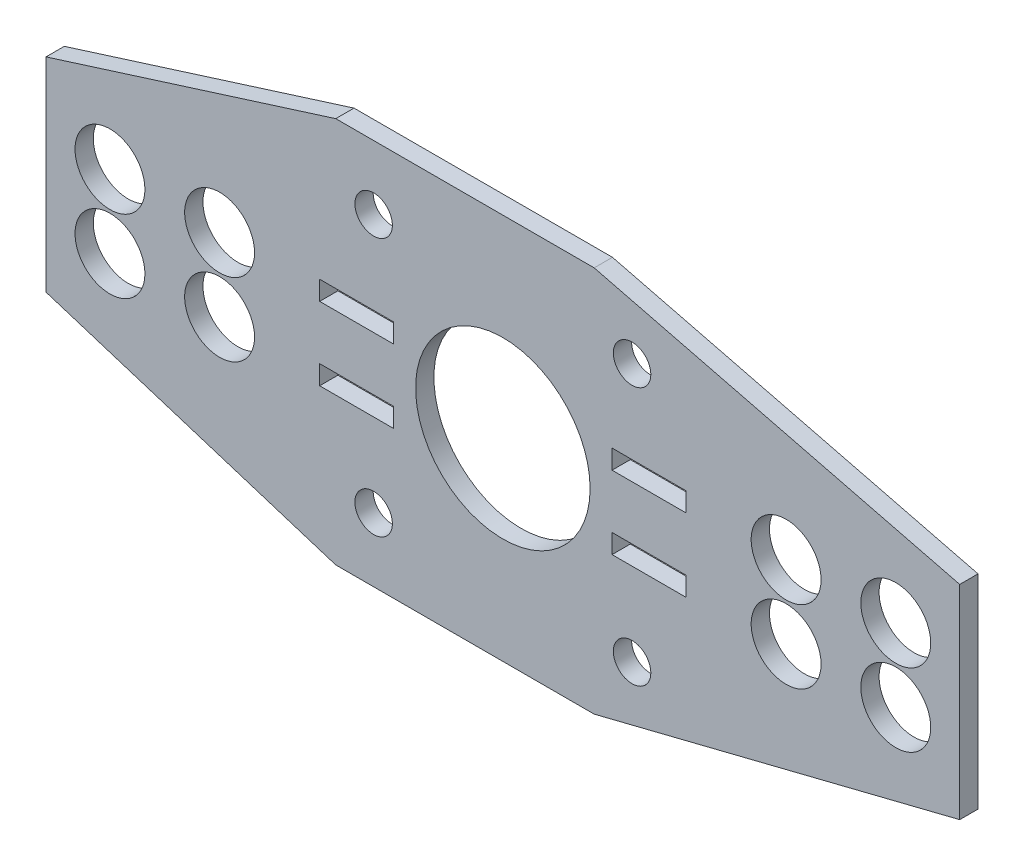
from build123d import *

# Parameters (mm, degrees)
SKETCH_1_R      = 3.825
SKETCH_1_R_2    = 2.05
SKETCH_1_R_3    = 9.55
SKETCH_1_W      = 8.1
SKETCH_1_H      = 2.1
EXTRUDE_1_DEPTH = 2


with BuildPart() as part:
    # 草图1 → 凸台-拉伸1 (new body)
    with BuildSketch(Plane.XY):
        Polygon((81, -15.149736791), (81, 7.149736791), (40.992999038, 17.149736791), (12.70872779, 17.149736791), (-19, 7.149736791), (-19, -15.149736791), (12.70872779, -25.149736791), (40.992999038, -25.149736791), align=None)
        Circle(SKETCH_1_R, mode=Mode.SUBTRACT)
        with Locations((62, 0)):
            Circle(SKETCH_1_R, mode=Mode.SUBTRACT)
        with Locations((62, -8)):
            Circle(SKETCH_1_R, mode=Mode.SUBTRACT)
        with Locations((0, -8)):
            Circle(SKETCH_1_R, mode=Mode.SUBTRACT)
        with Locations((45.142135624, 10.142135624)):
            Circle(SKETCH_1_R_2, mode=Mode.SUBTRACT)
        with Locations((45.142135624, -18.142135624)):
            Circle(SKETCH_1_R_2, mode=Mode.SUBTRACT)
        with Locations((16.857864376, -18.142135624)):
            Circle(SKETCH_1_R_2, mode=Mode.SUBTRACT)
        with Locations((16.857864376, 10.142135624)):
            Circle(SKETCH_1_R_2, mode=Mode.SUBTRACT)
        with Locations((74, 0)):
            Circle(SKETCH_1_R, mode=Mode.SUBTRACT)
        with Locations((74, -8)):
            Circle(SKETCH_1_R, mode=Mode.SUBTRACT)
        with Locations((-12, -8)):
            Circle(SKETCH_1_R, mode=Mode.SUBTRACT)
        with Locations((-12, 0)):
            Circle(SKETCH_1_R, mode=Mode.SUBTRACT)
        with Locations((31, -4)):
            Circle(SKETCH_1_R_3, mode=Mode.SUBTRACT)
        with Locations((15, 0)):
            Rectangle(SKETCH_1_W, SKETCH_1_H, mode=Mode.SUBTRACT)
        with Locations((47, 0)):
            Rectangle(SKETCH_1_W, SKETCH_1_H, mode=Mode.SUBTRACT)
        with Locations((47, -8)):
            Rectangle(SKETCH_1_W, SKETCH_1_H, mode=Mode.SUBTRACT)
        with Locations((15, -8)):
            Rectangle(SKETCH_1_W, SKETCH_1_H, mode=Mode.SUBTRACT)
    extrude(amount=EXTRUDE_1_DEPTH)


solid = part.part
